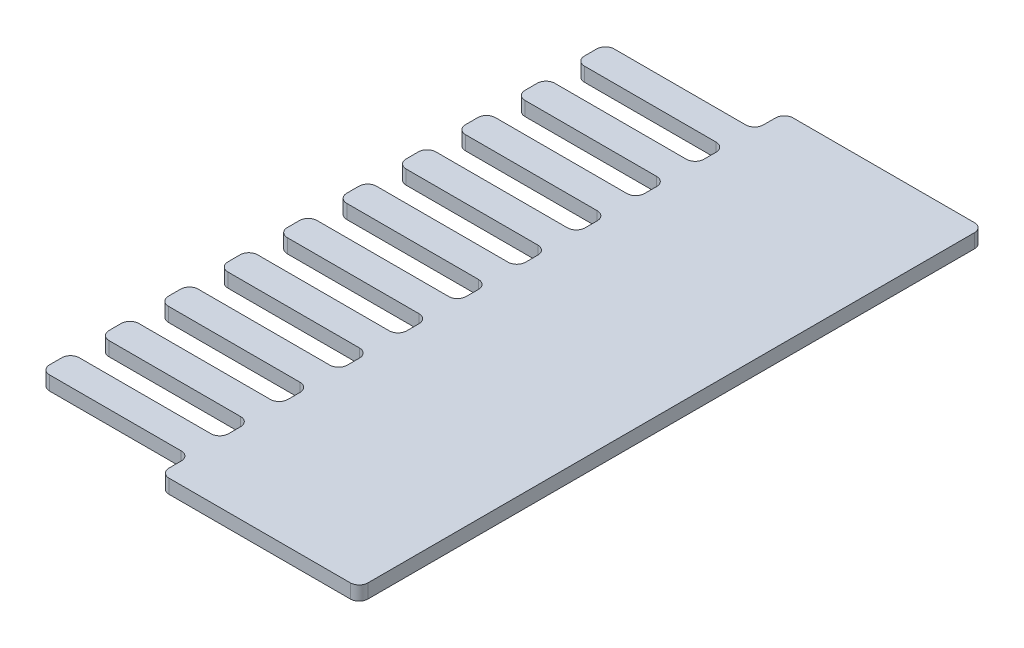
from build123d import *

# Parameters (mm, degrees)
BOSS_EXTRUDE1_DEPTH = 1.2


with BuildPart() as part:
    # Sketch1 → Boss-Extrude1 (new body)
    with BuildSketch(Plane(origin=(0, 0, 0), x_dir=(1, 0, 0), z_dir=(0, 1, 0))):
        with BuildLine():
            Line((-0.75, 2.54), (-12, 2.54))
            ThreePointArc((-12, 2.54), (-12.530330086, 2.759669914), (-12.75, 3.29))
            Line((-12.75, 3.29), (-12.75, 4.33))
            ThreePointArc((-12.75, 4.33), (-12.530330086, 4.860330086), (-12, 5.08))
            Line((-12, 5.08), (-0.75, 5.08))
            ThreePointArc((-0.75, 5.08), (-0.219669914, 5.299669914), (0, 5.83))
            Line((0, 5.83), (0, 6.87))
            ThreePointArc((0, 6.87), (-0.219669914, 7.400330086), (-0.75, 7.62))
            Line((-0.75, 7.62), (-12, 7.62))
            ThreePointArc((-12, 7.62), (-12.530330086, 7.839669914), (-12.75, 8.37))
            Line((-12.75, 8.37), (-12.75, 9.41))
            ThreePointArc((-12.75, 9.41), (-12.530330086, 9.940330086), (-12, 10.16))
            Line((-12, 10.16), (-0.75, 10.16))
            ThreePointArc((-0.75, 10.16), (-0.219669914, 10.379669914), (0, 10.91))
            Line((0, 10.91), (0, 11.95))
            ThreePointArc((0, 11.95), (-0.219669914, 12.480330086), (-0.75, 12.7))
            Line((-0.75, 12.7), (-12, 12.7))
            ThreePointArc((-12, 12.7), (-12.530330086, 12.919669914), (-12.75, 13.45))
            Line((-12.75, 13.45), (-12.75, 14.49))
            ThreePointArc((-12.75, 14.49), (-12.530330086, 15.020330086), (-12, 15.24))
            Line((-12, 15.24), (-0.75, 15.24))
            ThreePointArc((-0.75, 15.24), (-0.219669914, 15.459669914), (0, 15.99))
            Line((0, 15.99), (0, 17.03))
            ThreePointArc((0, 17.03), (-0.219669914, 17.560330086), (-0.75, 17.78))
            Line((-0.75, 17.78), (-12, 17.78))
            ThreePointArc((-12, 17.78), (-12.530330086, 17.999669914), (-12.75, 18.53))
            Line((-12.75, 18.53), (-12.75, 19.57))
            ThreePointArc((-12.75, 19.57), (-12.530330086, 20.100330086), (-12, 20.32))
            Line((-12, 20.32), (-0.75, 20.32))
            ThreePointArc((-0.75, 20.32), (-0.219669914, 20.539669914), (0, 21.07))
            Line((0, 21.07), (0, 22.11))
            ThreePointArc((0, 22.11), (-0.219669914, 22.640330086), (-0.75, 22.86))
            Line((-0.75, 22.86), (-12, 22.86))
            ThreePointArc((-12, 22.86), (-12.530330086, 23.079669914), (-12.75, 23.61))
            Line((-12.75, 23.61), (-12.75, 24.65))
            ThreePointArc((-12.75, 24.65), (-12.530330086, 25.180330086), (-12, 25.4))
            Line((-12, 25.4), (-0.75, 25.4))
            ThreePointArc((-0.75, 25.4), (-0.219669914, 25.619669914), (0, 26.15))
            Line((0, 26.15), (0, 27.19))
            ThreePointArc((0, 27.19), (-0.219669914, 27.720330086), (-0.75, 27.94))
            Line((-0.75, 27.94), (-12, 27.94))
            ThreePointArc((-12, 27.94), (-12.530330086, 28.159669914), (-12.75, 28.69))
            Line((-12.75, 28.69), (-12.75, 29.73))
            ThreePointArc((-12.75, 29.73), (-12.530330086, 30.260330086), (-12, 30.48))
            Line((-12, 30.48), (-0.75, 30.48))
            ThreePointArc((-0.75, 30.48), (-0.219669914, 30.699669914), (0, 31.23))
            Line((0, 31.23), (0, 32.27))
            ThreePointArc((0, 32.27), (-0.219669914, 32.800330086), (-0.75, 33.02))
            Line((-0.75, 33.02), (-12, 33.02))
            ThreePointArc((-12, 33.02), (-12.530330086, 33.239669914), (-12.75, 33.77))
            Line((-12.75, 33.77), (-12.75, 34.81))
            ThreePointArc((-12.75, 34.81), (-12.530330086, 35.340330086), (-12, 35.56))
            Line((-12, 35.56), (-0.75, 35.56))
            ThreePointArc((-0.75, 35.56), (-0.219669914, 35.779669914), (0, 36.31))
            Line((0, 36.31), (0, 37.35))
            ThreePointArc((0, 37.35), (-0.219669914, 37.880330086), (-0.75, 38.1))
            Line((-0.75, 38.1), (-12, 38.1))
            ThreePointArc((-12, 38.1), (-12.530330086, 38.319669914), (-12.75, 38.85))
            Line((-12.75, 38.85), (-12.75, 39.89))
            ThreePointArc((-12.75, 39.89), (-12.530330086, 40.420330086), (-12, 40.64))
            Line((-12, 40.64), (-0.75, 40.64))
            ThreePointArc((-0.75, 40.64), (-0.219669914, 40.859669914), (0, 41.39))
            Line((0, 41.39), (0, 42.43))
            ThreePointArc((0, 42.43), (-0.219669914, 42.960330086), (-0.75, 43.18))
            Line((-0.75, 43.18), (-12, 43.18))
            ThreePointArc((-12, 43.18), (-12.530330086, 43.399669914), (-12.75, 43.93))
            Line((-12.75, 43.93), (-12.75, 44.97))
            ThreePointArc((-12.75, 44.97), (-12.530330086, 45.500330086), (-12, 45.72))
            Line((-12, 45.72), (-0.75, 45.72))
            ThreePointArc((-0.75, 45.72), (-0.219669914, 45.939669914), (0, 46.47))
            Line((0, 46.47), (0, 47.51))
            ThreePointArc((0, 47.51), (-0.219669914, 48.040330086), (-0.75, 48.26))
            Line((-0.75, 48.26), (-12, 48.26))
            ThreePointArc((-12, 48.26), (-12.530330086, 48.479669914), (-12.75, 49.01))
            Line((-12.75, 49.01), (-12.75, 50.05))
            ThreePointArc((-12.75, 50.05), (-12.530330086, 50.580330086), (-12, 50.8))
            Line((-12, 50.8), (-0.75, 50.8))
            ThreePointArc((-0.75, 50.8), (-0.219669914, 51.019669914), (0, 51.55))
            Line((0, 51.55), (0, 52.59))
            ThreePointArc((0, 52.59), (0.219669914, 53.120330086), (0.75, 53.34))
            Line((0.75, 53.34), (16.25, 53.34))
            ThreePointArc((16.25, 53.34), (16.780330086, 53.120330086), (17, 52.59))
            Line((17, 52.59), (17, 0.75))
            ThreePointArc((17, 0.75), (16.780330086, 0.219669914), (16.25, 0))
            Line((16.25, 0), (0.75, 0))
            ThreePointArc((0.75, 0), (0.219669914, 0.219669914), (0, 0.75))
            Line((0, 0.75), (0, 1.79))
            ThreePointArc((0, 1.79), (-0.219669914, 2.320330086), (-0.75, 2.54))
        make_face()
    extrude(amount=BOSS_EXTRUDE1_DEPTH)


solid = part.part
